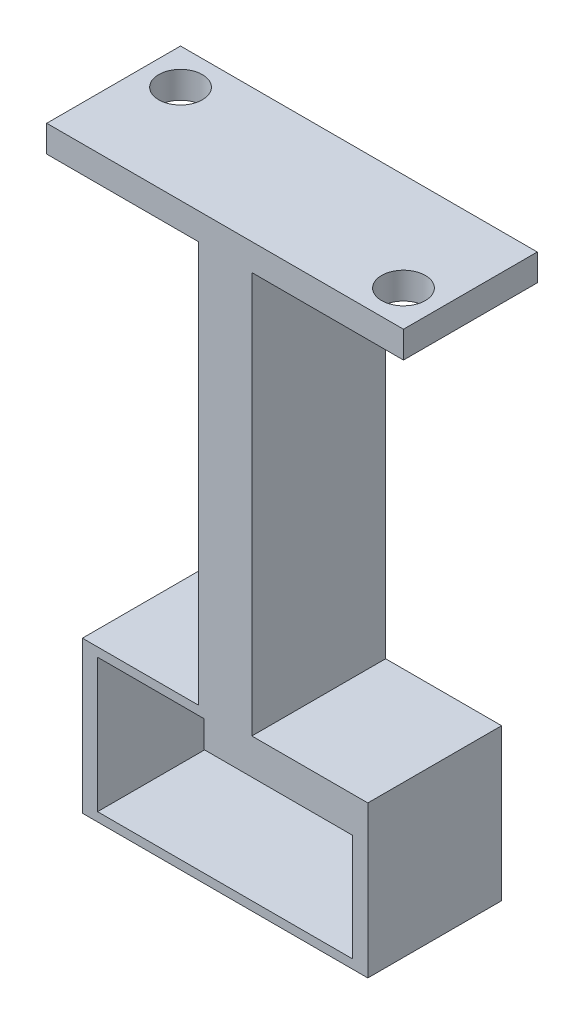
from build123d import *

# Parameters (mm, degrees)
ESBO_O1_W                     = 32
ESBO_O1_H                     = 17
RESSALTO_EXTRUS_O1_DEPTH      = 15
RESSALTO_EXTRUS_O2_DEPTH      = 45
RESSALTO_EXTRUS_O2_DEPTH_BACK = 3
ESBO_O2_W                     = 6
ESBO_O2_H                     = 15
ESBO_O3_W                     = 40
ESBO_O3_H                     = 15
RESSALTO_EXTRUS_O3_DEPTH      = 3
CORTE_EXTRUS_O1_DEPTH         = 84.736797348
CORTE_EXTRUS_O1_DEPTH_BACK    = 6
ESBO_O5_R                     = 2.45
CORTE_EXTRUS_O2_DEPTH         = 12
CORTE_EXTRUS_O3_DEPTH         = 72.02091848
CORTE_EXTRUS_O3_DEPTH_BACK    = 72.02091848
ESBO_O8_R                     = 1
CORTE_EXTRUS_O4_DEPTH         = 72.588901806
CORTE_EXTRUS_O4_DEPTH_BACK    = 72.588901806
ESBO_O9_W                     = 20.5
ESBO_O9_H                     = 9


with BuildPart() as part:
    # Esboço1 → Ressalto-extrusão1 (new body)
    with BuildSketch(Plane.XY):
        with Locations((-30.614733331, -8.145893332)):
            Rectangle(ESBO_O1_W, ESBO_O1_H)
    extrude(amount=RESSALTO_EXTRUS_O1_DEPTH)

    # Esboço2 → Ressalto-extrusão2 (add, two sides: drawn at the far end of the back side and taken through both)
    with BuildSketch(Plane(origin=(0, 0.354106668, 0), x_dir=(1, 0, 0), z_dir=(0, 1, 0)).offset(-RESSALTO_EXTRUS_O2_DEPTH_BACK)):
        with Locations((-30.614733331, -7.5)):
            Rectangle(ESBO_O2_W, ESBO_O2_H)
    extrude(amount=RESSALTO_EXTRUS_O2_DEPTH + RESSALTO_EXTRUS_O2_DEPTH_BACK)

    # Esboço3 → Ressalto-extrusão3 (add)
    with BuildSketch(Plane(origin=(0, 45.354106668, 0), x_dir=(1, 0, 0), z_dir=(0, 1, 0))):
        with Locations((-30.614733331, -7.5)):
            Rectangle(ESBO_O3_W, ESBO_O3_H)
    extrude(amount=RESSALTO_EXTRUS_O3_DEPTH)

    # Esboço5 → Corte-extrusão1 (cut, two sides: drawn at the far end of the back side and taken through both)
    with BuildSketch(Plane(origin=(0, 48.354106668, 0), x_dir=(1, 0, 0), z_dir=(0, 1, 0)).offset(-CORTE_EXTRUS_O1_DEPTH_BACK)):
        with Locations(Location((-46.614733331, -4, 0), (0, 0, 90))):
            Circle(ESBO_O5_R)
        with Locations(Location((-14.614733331, -11, 0), (0, 0, 90))):
            Circle(ESBO_O5_R)
    extrude(amount=CORTE_EXTRUS_O1_DEPTH + CORTE_EXTRUS_O1_DEPTH_BACK, mode=Mode.SUBTRACT)

    # Esboço7 → Corte-extrusão2 (cut)
    with BuildSketch(Plane.XY.offset(15)):
        Polygon((-44.914733331, -15.645893332), (-44.914733331, -0.645893332), (-32.972451845, -0.645893332), (-32.972451845, -3.645893332), (-16.314733331, -3.645893332), (-16.314733331, -15.645893332), align=None)
    extrude(amount=-CORTE_EXTRUS_O2_DEPTH, mode=Mode.SUBTRACT)

    # Esboço8 → Corte-extrusão3 (cut, two sides: drawn at the far end of the back side and taken through both)
    with BuildSketch(Plane.XY.offset(3).offset(-CORTE_EXTRUS_O3_DEPTH_BACK)):
        with Locations((-42.364733331, -13.395893332)):
            Circle(ESBO_O8_R)
        with Locations((-18.864733331, -5.895893332)):
            Circle(ESBO_O8_R)
    extrude(amount=CORTE_EXTRUS_O3_DEPTH + CORTE_EXTRUS_O3_DEPTH_BACK, mode=Mode.SUBTRACT)

    # Esboço9 → Corte-extrusão4 (cut, two sides: drawn at the far end of the back side and taken through both)
    with BuildSketch(Plane(origin=(0, 0, 0), x_dir=(-1, 0, 0), z_dir=(0, 0, -1)).offset(-CORTE_EXTRUS_O4_DEPTH_BACK)):
        with Locations((30.614733331, -9.645893332)):
            Rectangle(ESBO_O9_W, ESBO_O9_H)
    extrude(amount=CORTE_EXTRUS_O4_DEPTH + CORTE_EXTRUS_O4_DEPTH_BACK, mode=Mode.SUBTRACT)


solid = part.part
